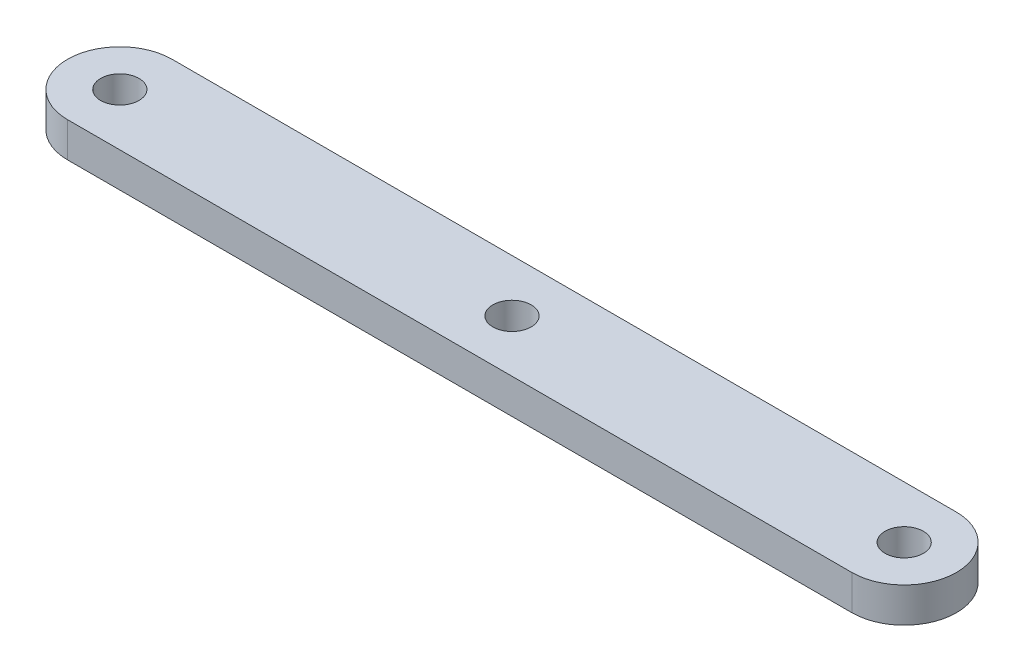
from build123d import *

# Parameters (mm, degrees)
EXTRUDE_1_DEPTH     = 2
SKETCH_2_R          = 1.1
CUT_EXTRUDE_1_DEPTH = 49.135226186


with BuildPart() as part:
    # ｽｹｯﾁ1 → ﾎﾞｽ - 押し出し1 (new body)
    with BuildSketch(Plane(origin=(0, 0, 0), x_dir=(1, 0, 0), z_dir=(0, 1, 0))):
        with BuildLine():
            Line((0, 3), (45, 3))
            ThreePointArc((45, 3), (48, 0), (45, -3))
            Line((45, -3), (0, -3))
            ThreePointArc((0, -3), (-3, 0), (0, 3))
        make_face()
    extrude(amount=EXTRUDE_1_DEPTH)

    # ｽｹｯﾁ2 → ｶｯﾄ - 押し出し1 (cut, through all)
    with BuildSketch(Plane(origin=(0, 2, 0), x_dir=(1, 0, 0), z_dir=(0, 1, 0))):
        with Locations(Location((0, 0, 0), (0, 0, 270))):
            Circle(SKETCH_2_R)
        with Locations(Location((45, 0, 0), (0, 0, 270))):
            Circle(SKETCH_2_R)
        with Locations(Location((22.5, 0, 0), (0, 0, 270))):
            Circle(SKETCH_2_R)
    extrude(amount=-CUT_EXTRUDE_1_DEPTH, mode=Mode.SUBTRACT)


solid = part.part
